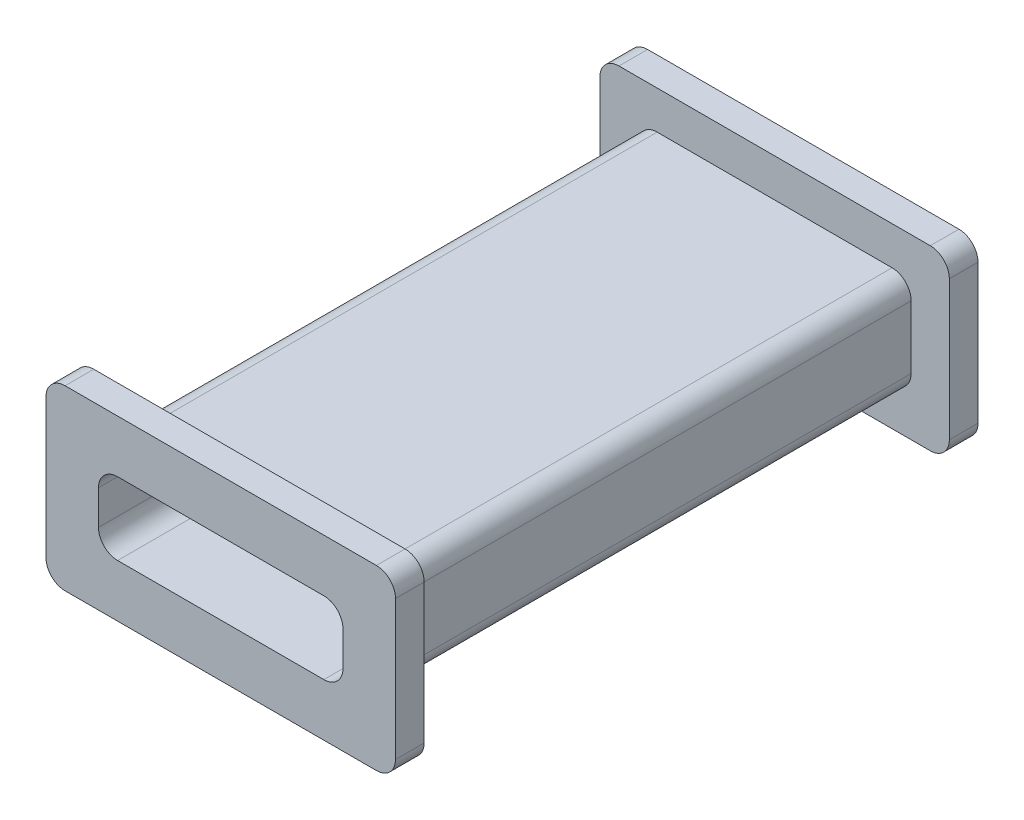
from build123d import *

# Parameters (mm, degrees)
SKETCH1_W            = 28.6
SKETCH1_H            = 10.6
SKETCH1_W_2          = 25.6
SKETCH1_H_2          = 7.6
BOSS_EXTRUDE1_DEPTH  = 55
SKETCH2_W            = 36.6
SKETCH2_H            = 18.6
SKETCH2_W_2          = 25.6
SKETCH2_H_2          = 7.6
BOSS_EXTRUDE3_DEPTH  = 3
FILLET2_R            = 2
FILLET1_R            = 2
FILLET2_OF_MIRROR2_R = 2
FILLET3_R            = 2


with BuildPart() as part:
    # Sketch1 → Boss-Extrude1 (new body)
    with BuildSketch(Plane.XY):
        Rectangle(SKETCH1_W, SKETCH1_H)
        Rectangle(SKETCH1_W_2, SKETCH1_H_2, mode=Mode.SUBTRACT)
    extrude(amount=BOSS_EXTRUDE1_DEPTH)

    # Sketch2 → Boss-Extrude3 (add)
    with BuildSketch(Plane.XY.offset(55)):
        Rectangle(SKETCH2_W, SKETCH2_H)
        Rectangle(SKETCH2_W_2, SKETCH2_H_2, mode=Mode.SUBTRACT)
    boss_extrude3 = extrude(amount=BOSS_EXTRUDE3_DEPTH)

    # Fillet2
    fillet2_edges = [part.edges().sort_by_distance(p)[0] for p in [
        (18.3, -9.3, 56.5),
        (18.3, 9.3, 56.5),
        (-18.3, 9.3, 56.5),
        (-18.3, -9.3, 56.5),
    ]]
    fillet(fillet2_edges, radius=FILLET2_R)

    # Fillet1
    fillet1_edges = [part.edges().sort_by_distance(p)[0] for p in [
        (14.3, -5.3, 27.5),
        (-14.3, -5.3, 27.5),
        (-14.3, 5.3, 27.5),
        (14.3, 5.3, 27.5),
    ]]
    fillet(fillet1_edges, radius=FILLET1_R)

    # Mirror2: Boss-Extrude3 across plane
    add(boss_extrude3.mirror(Plane(origin=(0, 0, 27.5), x_dir=(1, 0, 0), z_dir=(0, 0, -1))))

    # Fillet2 of Mirror2
    fillet2_of_mirror2_edges = [part.edges().sort_by_distance(p)[0] for p in [
        (18.3, -9.3, -1.5),
        (18.3, 9.3, -1.5),
        (-18.3, 9.3, -1.5),
        (-18.3, -9.3, -1.5),
    ]]
    fillet(fillet2_of_mirror2_edges, radius=FILLET2_OF_MIRROR2_R)

    # Fillet3
    fillet3_edges = [part.edges().sort_by_distance(p)[0] for p in [
        (12.8, -3.8, 27.5),
        (12.8, 3.8, 27.5),
        (-12.8, 3.8, 27.5),
        (-12.8, -3.8, 27.5),
    ]]
    fillet(fillet3_edges, radius=FILLET3_R)


solid = part.part
